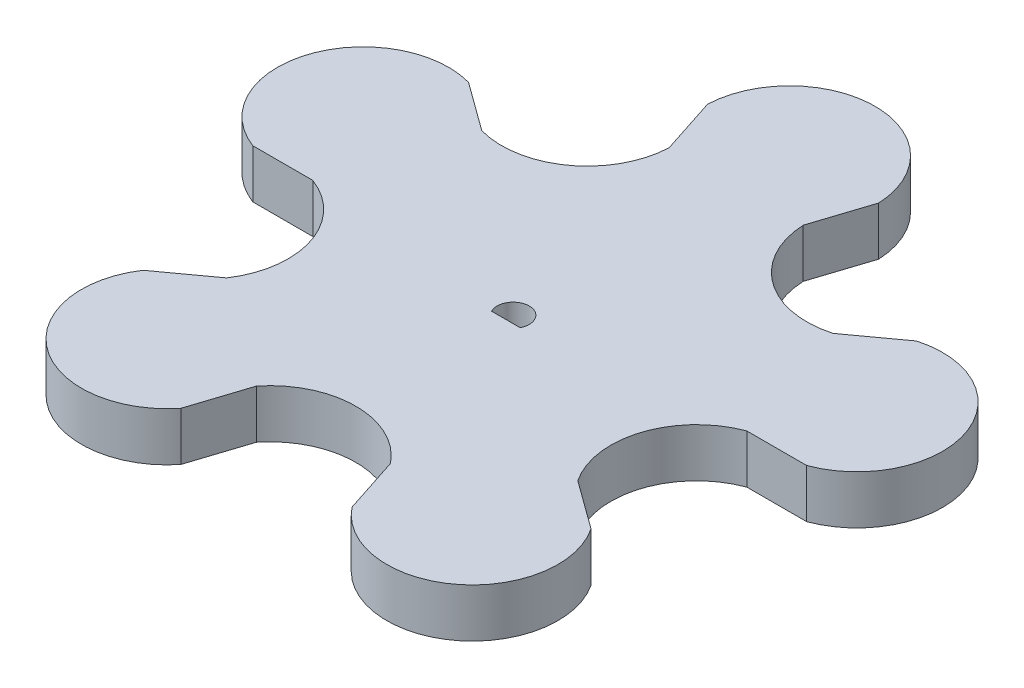
from build123d import *

# Parameters (mm, degrees)
BOSS_EXTRUDE1_DEPTH = 3.175
CUT_EXTRUDE1_DEPTH  = 46.155334956


with BuildPart() as part:
    # Sketch2 → Boss-Extrude1 (new body)
    with BuildSketch(Plane(origin=(0, 0, 0), x_dir=(1, 0, 0), z_dir=(0, 1, 0))):
        with BuildLine():
            Line((-5.582827527, 34.123976372), (-4.37531266, 30.407627744))
            ThreePointArc((-4.37531266, 30.407627744), (-6.673596197, 26.127217151), (-11.454717255, 25.264139232))
            Line((-11.454717255, 25.264139232), (-14.61603222, 27.560968998))
            ThreePointArc((-14.61603222, 27.560968998), (-21.427113101, 23.90389108), (-18.066409385, 16.9418))
            Line((-18.066409385, 16.9418), (-14.15880919, 16.9418))
            ThreePointArc((-14.15880919, 16.9418), (-10.798105475, 13.433282849), (-11.454717255, 8.619460768))
            Line((-11.454717255, 8.619460768), (-14.61603222, 6.322631002))
            ThreePointArc((-14.61603222, 6.322631002), (-13.242684177, -1.28519108), (-5.582827527, -0.240376372))
            Line((-5.582827527, -0.240376372), (-4.37531266, 3.475972256))
            ThreePointArc((-4.37531266, 3.475972256), (0, 5.588), (4.37531266, 3.475972256))
            Line((4.37531266, 3.475972256), (5.582827527, -0.240376372))
            ThreePointArc((5.582827527, -0.240376372), (13.242684177, -1.28519108), (14.61603222, 6.322631002))
            Line((14.61603222, 6.322631002), (11.454717255, 8.619460768))
            ThreePointArc((11.454717255, 8.619460768), (10.798105475, 13.433282849), (14.15880919, 16.9418))
            Line((14.15880919, 16.9418), (18.066409385, 16.9418))
            ThreePointArc((18.066409385, 16.9418), (21.427113101, 23.90389108), (14.61603222, 27.560968998))
            Line((14.61603222, 27.560968998), (11.454717255, 25.264139232))
            ThreePointArc((11.454717255, 25.264139232), (6.673596197, 26.127217151), (4.37531266, 30.407627744))
            Line((4.37531266, 30.407627744), (5.582827527, 34.123976372))
            ThreePointArc((5.582827527, 34.123976372), (0, 39.4716), (-5.582827527, 34.123976372))
        make_face()
    extrude(amount=BOSS_EXTRUDE1_DEPTH)

    # Sketch3 → Cut-Extrude1 (cut, through all)
    with BuildSketch(Plane(origin=(0, 3.175, 0), x_dir=(1, 0, 0), z_dir=(0, 1, 0))):
        with BuildLine():
            Line((-0.933255592, 15.381358575), (0.933255592, 15.381358575))
            ThreePointArc((0.933255592, 15.381358575), (0, 16.905358575), (-0.933255592, 15.381358575))
        make_face()
    extrude(amount=-CUT_EXTRUDE1_DEPTH, mode=Mode.SUBTRACT)


solid = part.part
